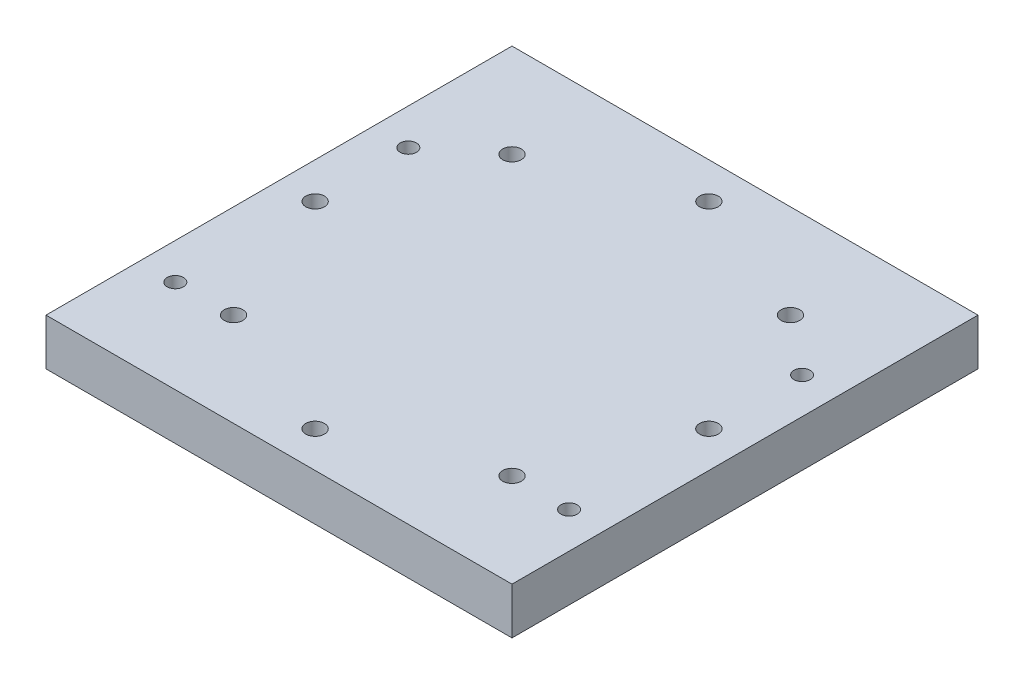
from build123d import *

# Parameters (mm, degrees)
SKETCH2_W           = 100
SKETCH2_H           = 100
SKETCH2_R           = 2
SKETCH2_R_2         = 1.75
BOSS_EXTRUDE1_DEPTH = 10


with BuildPart() as part:
    # Sketch2 → Boss-Extrude1 (new body)
    with BuildSketch(Plane(origin=(0, 0, 0), x_dir=(1, 0, 0), z_dir=(0, 1, 0))):
        with Locations((50, 50)):
            Rectangle(SKETCH2_W, SKETCH2_H)
        with Locations(Location((50, 92.25, 0), (0, 0, 270))):
            Circle(SKETCH2_R, mode=Mode.SUBTRACT)
        with Locations(Location((79.875261505, 79.875261505, 0), (0, 0, 270))):
            Circle(SKETCH2_R, mode=Mode.SUBTRACT)
        with Locations(Location((92.25, 50, 0), (0, 0, 270))):
            Circle(SKETCH2_R, mode=Mode.SUBTRACT)
        with Locations(Location((79.875261505, 20.124738495, 0), (0, 0, 270))):
            Circle(SKETCH2_R, mode=Mode.SUBTRACT)
        with Locations(Location((50, 7.75, 0), (0, 0, 270))):
            Circle(SKETCH2_R, mode=Mode.SUBTRACT)
        with Locations(Location((20.124738495, 20.124738495, 0), (0, 0, 270))):
            Circle(SKETCH2_R, mode=Mode.SUBTRACT)
        with Locations(Location((7.75, 50, 0), (0, 0, 270))):
            Circle(SKETCH2_R, mode=Mode.SUBTRACT)
        with Locations(Location((20.124738495, 79.875261505, 0), (0, 0, 270))):
            Circle(SKETCH2_R, mode=Mode.SUBTRACT)
        with Locations(Location((7.75, 20, 0), (0, 0, 270))):
            Circle(SKETCH2_R_2, mode=Mode.SUBTRACT)
        with Locations(Location((7.75, 70, 0), (0, 0, 90))):
            Circle(SKETCH2_R_2, mode=Mode.SUBTRACT)
        with Locations(Location((92.25, 20, 0), (0, 0, 90))):
            Circle(SKETCH2_R_2, mode=Mode.SUBTRACT)
        with Locations(Location((92.25, 70, 0), (0, 0, 270))):
            Circle(SKETCH2_R_2, mode=Mode.SUBTRACT)
    extrude(amount=BOSS_EXTRUDE1_DEPTH)


solid = part.part
